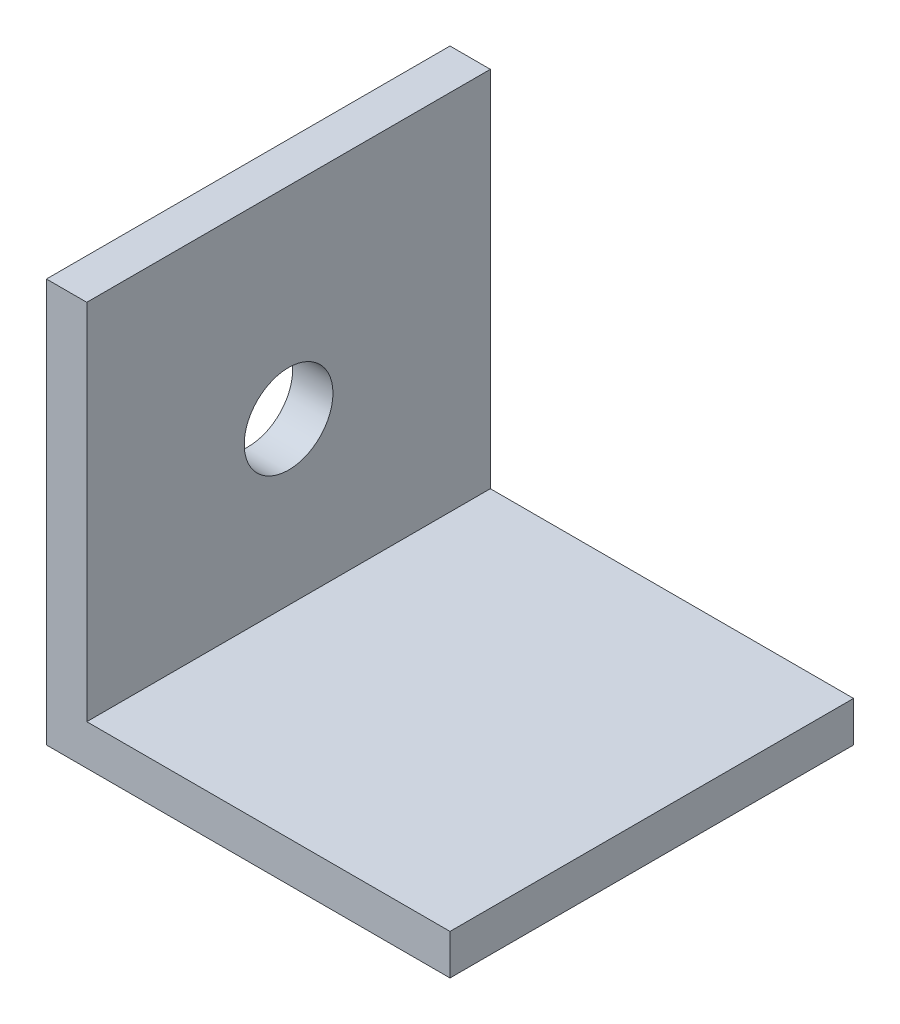
from build123d import *

# Parameters (mm, degrees)
EXTRUDE_THIN1_DEPTH = 25
SKETCH2_R           = 5.5
CUT_EXTRUDE1_DEPTH  = 5


with BuildPart() as part:
    # Sketch1 → Extrude-Thin1 (new, symmetric)
    with BuildSketch(Plane.XY):
        Polygon((50, 0), (0, 0), (0, 50), (5, 50), (5, 5), (50, 5), align=None)
    extrude(amount=EXTRUDE_THIN1_DEPTH, both=True)

    # Sketch2 → Cut-Extrude1 (cut)
    with BuildSketch(Plane.YZ):
        with Locations(Location((25, 0, 0), (0, 0, 270))):
            Circle(SKETCH2_R)
    extrude(amount=CUT_EXTRUDE1_DEPTH, mode=Mode.SUBTRACT)


solid = part.part
